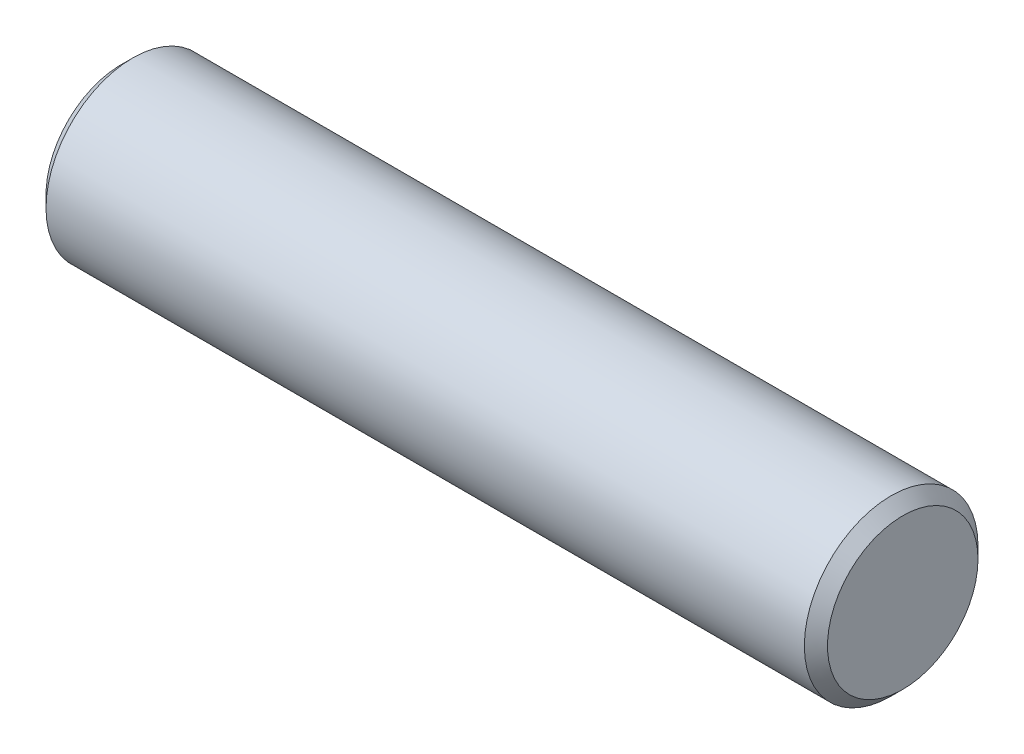
from build123d import *

# Parameters (mm, degrees)
SKETCH1_R           = 1.5
BOSS_EXTRUDE1_DEPTH = 6.75
CHAMFER1_SIZE       = 0.2


with BuildPart() as part:
    # Sketch1 → Boss-Extrude1 (new, symmetric)
    with BuildSketch(Plane(origin=(0, 0, 0), x_dir=(0, 0, -1), z_dir=(1, 0, 0))):
        Circle(SKETCH1_R)
    extrude(amount=BOSS_EXTRUDE1_DEPTH, both=True)

    # Chamfer1
    chamfer1_edges = [part.edges().sort_by_distance(p)[0] for p in [
        (-6.75, 0, 1.5),
        (6.75, 0, 1.5),
    ]]
    chamfer(chamfer1_edges, length=CHAMFER1_SIZE)


solid = part.part
